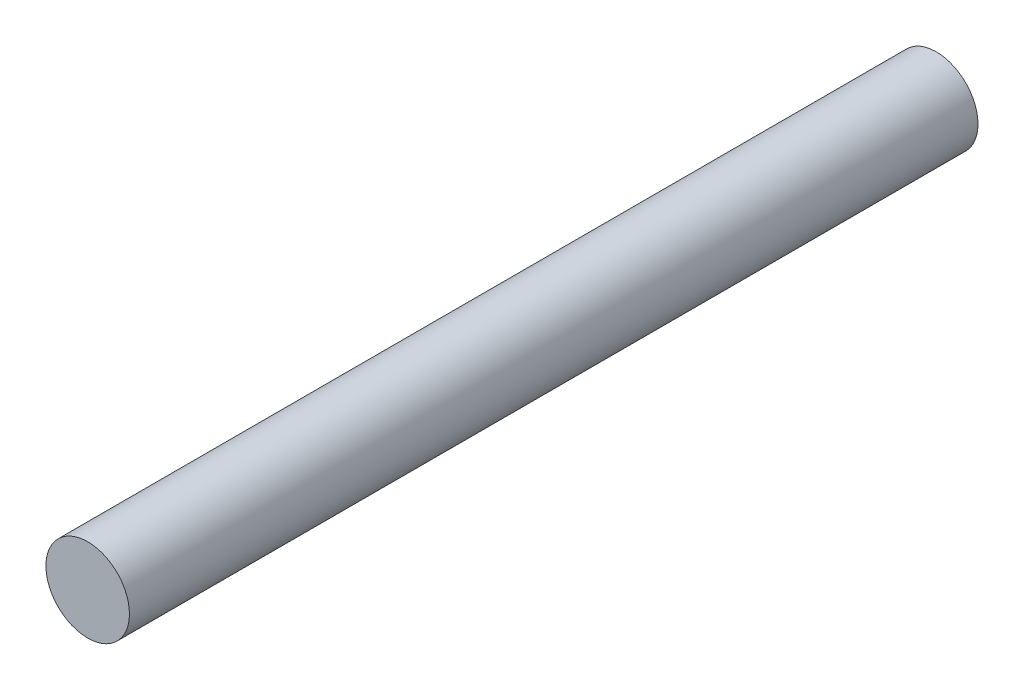
from build123d import *

# Parameters (mm, degrees)
SKETCH1_R           = 1.25
BOSS_EXTRUDE1_DEPTH = 25.4


with BuildPart() as part:
    # Sketch1 → Boss-Extrude1 (new body)
    with BuildSketch(Plane.XY):
        Circle(SKETCH1_R)
    extrude(amount=BOSS_EXTRUDE1_DEPTH)


solid = part.part
